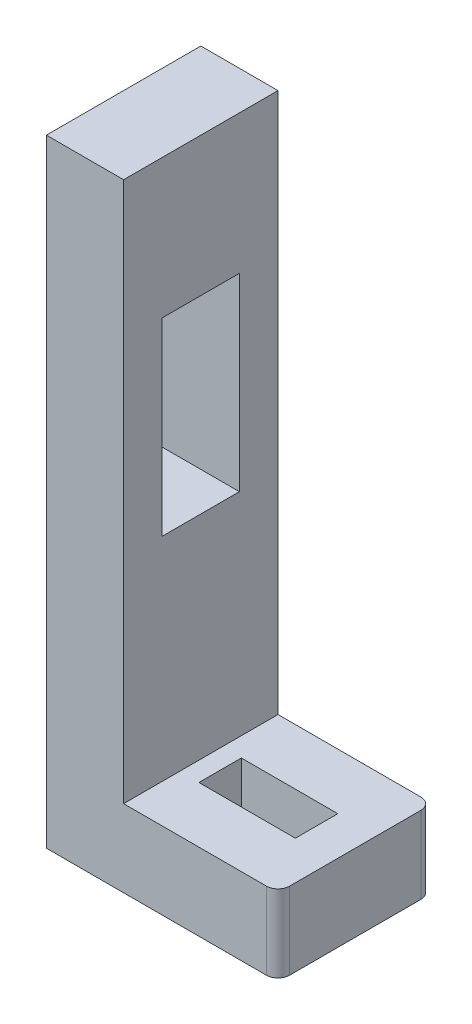
from build123d import *

# Parameters (mm, degrees)
BOSS_EXTRUDE1_DEPTH = 40
FILLET1_R           = 3
SKETCH2_W           = 25
SKETCH2_H           = 11
CUT_EXTRUDE1_DEPTH  = 158.48015748
SKETCH3_W           = 20
SKETCH3_H           = 49
CUT_EXTRUDE2_DEPTH  = 170.705627485


with BuildPart() as part:
    # Sketch1 → Boss-Extrude1 (new body)
    with BuildSketch(Plane.XY):
        Polygon((0, 0), (0, 160), (20, 160), (20, 20), (60, 20), (60, 0), align=None)
    extrude(amount=BOSS_EXTRUDE1_DEPTH)

    # Fillet1
    fillet1_edges = [part.edges().sort_by_distance(p)[0] for p in [
        (60, 10, 40),
        (60, 10, 0),
    ]]
    fillet(fillet1_edges, radius=FILLET1_R)

    # Sketch2 → Cut-Extrude1 (cut, through all)
    with BuildSketch(Plane(origin=(0, 20, 0), x_dir=(1, 0, 0), z_dir=(0, 1, 0))):
        with Locations((37.5, -20)):
            Rectangle(SKETCH2_W, SKETCH2_H)
    extrude(amount=-CUT_EXTRUDE1_DEPTH, mode=Mode.SUBTRACT)

    # Sketch3 → Cut-Extrude2 (cut, through all)
    with BuildSketch(Plane(origin=(20, 0, 0), x_dir=(0, 0, -1), z_dir=(1, 0, 0))):
        with Locations((-20, 99.5)):
            Rectangle(SKETCH3_W, SKETCH3_H)
    extrude(amount=-CUT_EXTRUDE2_DEPTH, mode=Mode.SUBTRACT)


solid = part.part
